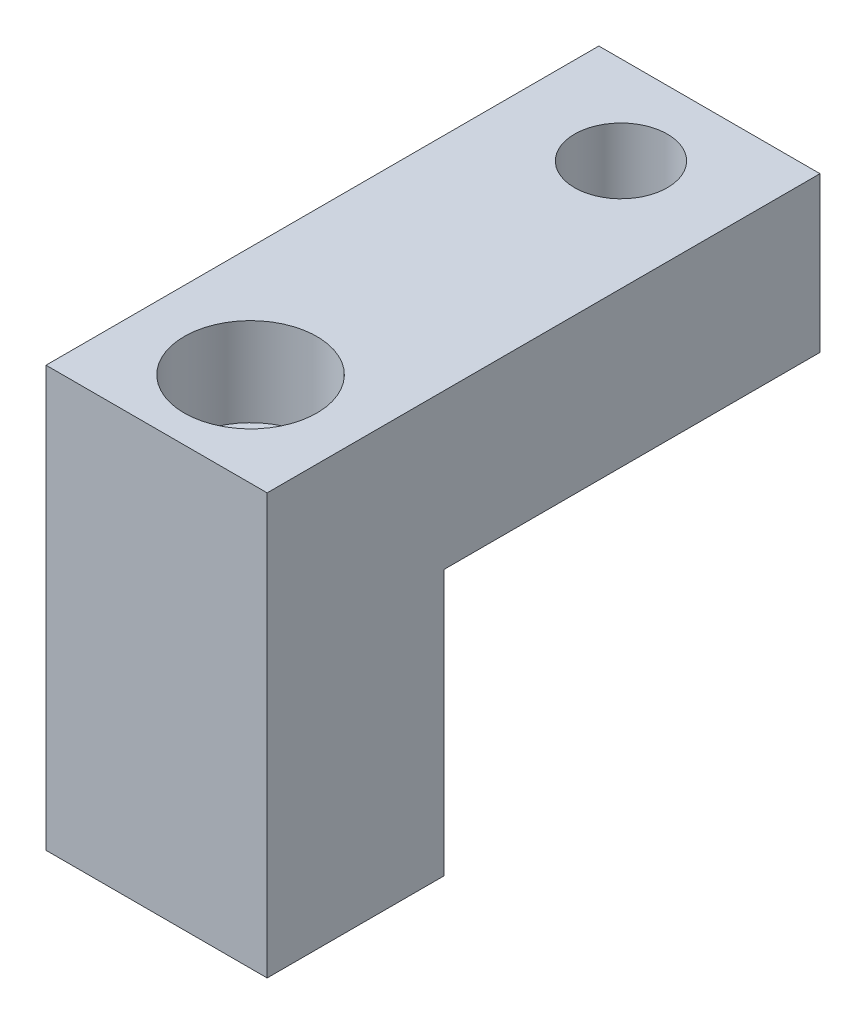
from build123d import *

# Parameters (mm, degrees)
SKETCH1_W           = 10
SKETCH1_H           = 25
SKETCH1_R           = 2.1
BOSS_EXTRUDE1_DEPTH = 7
SKETCH2_W           = 10
SKETCH2_H           = 8
BOSS_EXTRUDE2_DEPTH = 12
SKETCH3_R           = 1.7
CUT_EXTRUDE1_DEPTH  = 33.954514107
SKETCH4_R           = 3
CUT_EXTRUDE2_DEPTH  = 4


with BuildPart() as part:
    # Sketch1 → Boss-Extrude1 (new body)
    with BuildSketch(Plane(origin=(0, 0, 0), x_dir=(1, 0, 0), z_dir=(0, 1, 0))):
        with Locations((5, 12.5)):
            Rectangle(SKETCH1_W, SKETCH1_H)
        with Locations(Location((5, 21, 0), (0, 0, 270))):
            Circle(SKETCH1_R, mode=Mode.SUBTRACT)
    extrude(amount=BOSS_EXTRUDE1_DEPTH)

    # Sketch2 → Boss-Extrude2 (add)
    with BuildSketch(Plane(origin=(0, 0, 0), x_dir=(-1, 0, 0), z_dir=(0, -1, 0))):
        with Locations((-5, 4)):
            Rectangle(SKETCH2_W, SKETCH2_H)
    extrude(amount=BOSS_EXTRUDE2_DEPTH)

    # Sketch3 → Cut-Extrude1 (cut, through all)
    with BuildSketch(Plane(origin=(0, 7, 0), x_dir=(1, 0, 0), z_dir=(0, 1, 0))):
        with Locations(Location((5, 4.25, 0), (0, 0, 270))):
            Circle(SKETCH3_R)
    extrude(amount=-CUT_EXTRUDE1_DEPTH, mode=Mode.SUBTRACT)

    # Sketch4 → Cut-Extrude2 (cut)
    with BuildSketch(Plane(origin=(0, 7, 0), x_dir=(1, 0, 0), z_dir=(0, 1, 0))):
        with Locations(Location((5, 4.25, 0), (0, 0, 270))):
            Circle(SKETCH4_R)
    extrude(amount=-CUT_EXTRUDE2_DEPTH, mode=Mode.SUBTRACT)


solid = part.part
